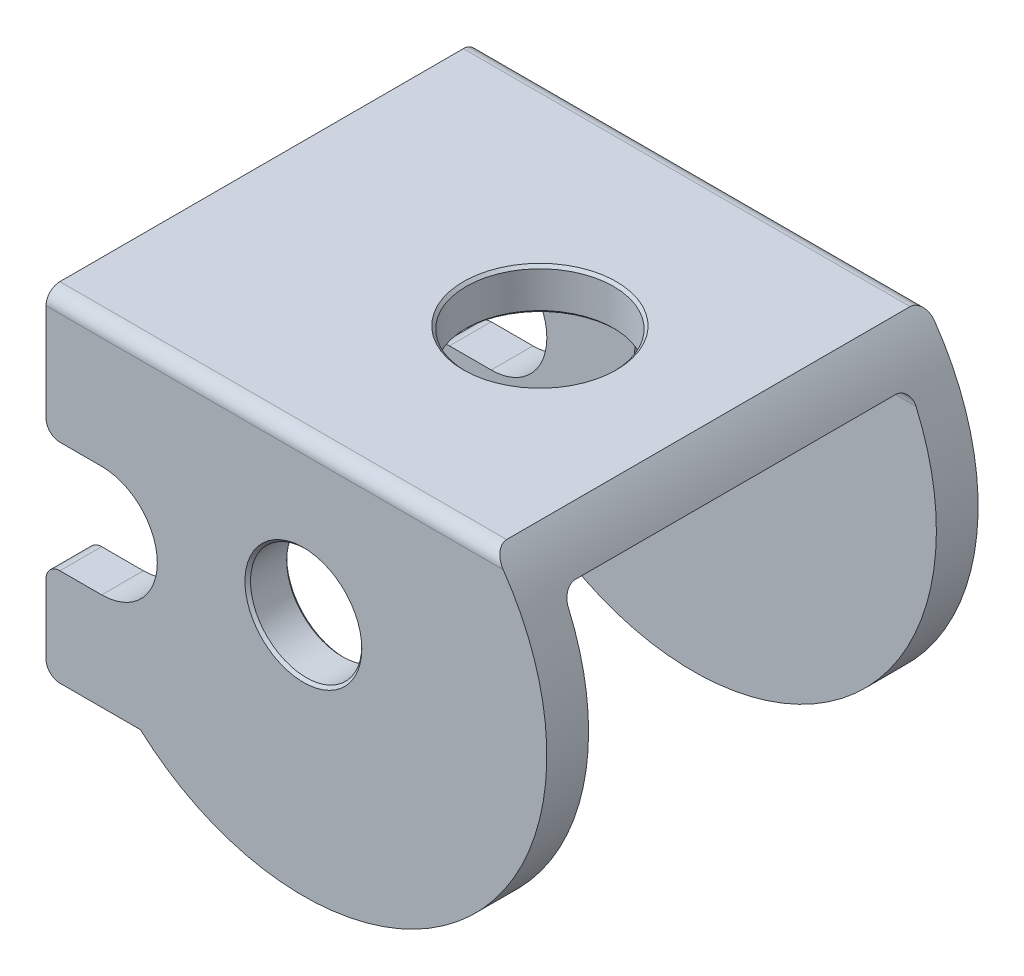
from build123d import *

# Parameters (mm, degrees)
EXTRUDE_1_DEPTH     = 15.5
SKETCH_2_R          = 4
CUT_EXTRUDE_1_DEPTH = 41.118574252
SKETCH_3_W          = 25
SKETCH_3_H          = 25.5
CUT_EXTRUDE_2_DEPTH = 43.924352063
CUT_EXTRUDE_3_REACH = 39.346
SKETCH_4_R          = 5.3
FILLET_1_R          = 1
FILLET_2_R          = 1
CHAMFER_1_SIZE      = 0.2


with BuildPart() as part:
    # ｽｹｯﾁ1 → ﾎﾞｽ - 押し出し1 (new, symmetric)
    with BuildSketch(Plane.XY):
        with BuildLine():
            Line((-18.5, 11), (-18.5, -13))
            Line((-18.5, -13), (-11.715374514, -13))
            ThreePointArc((-11.715374514, -13), (12.037359531, -12.702439747), (13.610657589, 11))
            Line((13.610657589, 11), (-18.5, 11))
        make_face()
    extrude(amount=EXTRUDE_1_DEPTH, both=True)

    # ｽｹｯﾁ2 → ｶｯﾄ - 押し出し1 (cut, through all)
    with BuildSketch(Plane.XY.offset(15.5)):
        Circle(SKETCH_2_R)
        with BuildLine():
            Line((-18.5, 2), (-14.5, 2))
            ThreePointArc((-14.5, 2), (-10.5, -2), (-14.5, -6))
            Line((-14.5, -6), (-18.5, -6))
            Line((-18.5, -6), (-18.5, 2))
        make_face()
    extrude(amount=-CUT_EXTRUDE_1_DEPTH, mode=Mode.SUBTRACT)

    # ｽｹｯﾁ3 → ｶｯﾄ - 押し出し2 (cut, through all)
    with BuildSketch(Plane.ZY.offset(18.5)):
        with Locations((0, -4.75)):
            Rectangle(SKETCH_3_W, SKETCH_3_H)
    extrude(amount=-CUT_EXTRUDE_2_DEPTH, mode=Mode.SUBTRACT)

    # ｽｹｯﾁ4 → ｶｯﾄ - 押し出し3 (cut, up to next)
    with BuildSketch(Plane(origin=(0, 11, 0), x_dir=(1, 0, 0), z_dir=(0, 1, 0)), mode=Mode.PRIVATE) as cut_extrude_3_sk1:
        with Locations(Location((1.5, 0, 0), (0, 0, 270))):
            Circle(SKETCH_4_R)
    cut_extrude_3_tool1 = extrude(cut_extrude_3_sk1.sketch, amount=-CUT_EXTRUDE_3_REACH, mode=Mode.PRIVATE) & part.part
    add(cut_extrude_3_tool1.solids().sort_by_distance((1.5, 11, 0))[0], mode=Mode.SUBTRACT)

    # ﾌｨﾚｯﾄ1
    fillet_1_edges = [part.edges().sort_by_distance(p)[0] for p in [
        (-18.5, -6, -14),
        (-18.5, 2, -14),
        (-18.5, -6, 14),
        (-18.5, 2, 14),
        (-18.5, -13, -14),
        (-18.5, -13, 14),
    ]]
    fillet(fillet_1_edges, radius=FILLET_1_R)

    # ﾌｨﾚｯﾄ2
    fillet_2_edges = [part.edges().sort_by_distance(p)[0] for p in [
        (-2.444671206, 11, 15.5),
        (-1.467808792, 8, -12.5),
        (-1.467808792, 8, 12.5),
        (-2.444671206, 11, -15.5),
    ]]
    fillet(fillet_2_edges, radius=FILLET_2_R)

    # 面取り1
    chamfer_1_edges = [part.edges().sort_by_distance(p)[0] for p in [
        (-4, 0, -15.5),
        (-4, 0, 15.5),
        (-4, 0, -12.5),
        (-4, 0, 12.5),
        (1.5, 11, -5.3),
        (1.5, 8, -5.3),
    ]]
    chamfer(chamfer_1_edges, length=CHAMFER_1_SIZE)


solid = part.part
